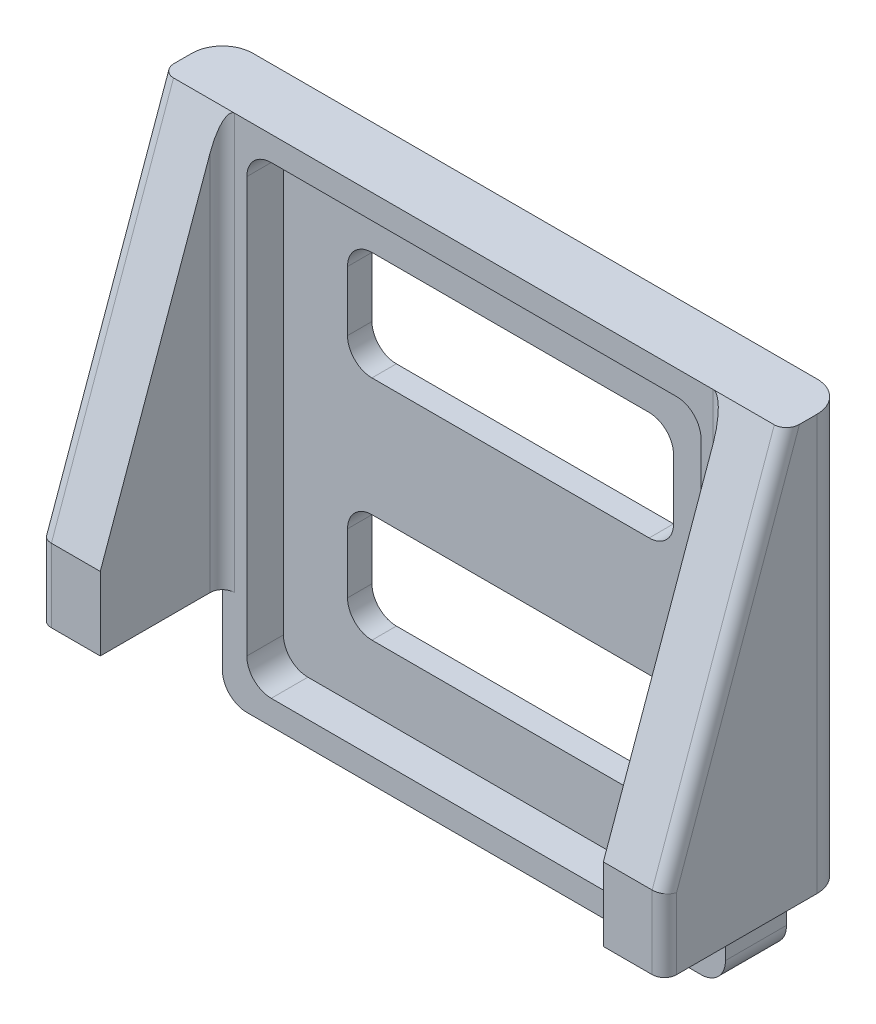
from build123d import *

# Parameters (mm, degrees)
SKETCH1_W           = 41.2
SKETCH1_H           = 42
BOSS_EXTRUDE1_DEPTH = 5
CUT_EXTRUDE1_DEPTH  = 3
CUT_EXTRUDE2_DEPTH  = 2
SKETCH6_W           = 5
SKETCH6_H           = 6
BOSS_EXTRUDE2_DEPTH = 5
SKETCH7_W           = 5
SKETCH7_H           = 6
BOSS_EXTRUDE3_DEPTH = 5
SKETCH13_W          = 5
SKETCH13_H          = 6
BOSS_EXTRUDE6_DEPTH = 10
SKETCH10_R          = 1.5
CUT_EXTRUDE3_DEPTH  = 6
FILLET4_R           = 2.5
BOSS_EXTRUDE7_DEPTH = 28
BOSS_EXTRUDE8_DEPTH = 5
FILLET10_R          = 1
FILLET12_R          = 2
FILLET13_R          = 1
FILLET14_R          = 1


with BuildPart() as part:
    # Sketch1 → Boss-Extrude1 (new body)
    with BuildSketch(Plane.XY):
        with Locations((20.6, -21)):
            Rectangle(SKETCH1_W, SKETCH1_H)
    extrude(amount=BOSS_EXTRUDE1_DEPTH)

    # Sketch2 → Cut-Extrude1 (cut)
    with BuildSketch(Plane.XY.offset(5)):
        with BuildLine():
            Line((4, -2), (37.2, -2))
            ThreePointArc((37.2, -2), (38.614213562, -2.585786438), (39.2, -4))
            Line((39.2, -4), (39.2, -38))
            ThreePointArc((39.2, -38), (38.614213562, -39.414213562), (37.2, -40))
            Line((37.2, -40), (4, -40))
            ThreePointArc((4, -40), (2.585786438, -39.414213562), (2, -38))
            Line((2, -38), (2, -4))
            ThreePointArc((2, -4), (2.585786438, -2.585786438), (4, -2))
        make_face()
    extrude(amount=-CUT_EXTRUDE1_DEPTH, mode=Mode.SUBTRACT)

    # Sketch3 → Cut-Extrude2 (cut)
    with BuildSketch(Plane.XY.offset(2)):
        with BuildLine():
            Line((9.25, -7.25), (31.95, -7.25))
            ThreePointArc((31.95, -7.25), (33.364213562, -7.835786438), (33.95, -9.25))
            Line((33.95, -9.25), (33.95, -14.15))
            ThreePointArc((33.95, -14.15), (33.364213562, -15.564213562), (31.95, -16.15))
            Line((31.95, -16.15), (9.25, -16.15))
            ThreePointArc((9.25, -16.15), (7.835786438, -15.564213562), (7.25, -14.15))
            Line((7.25, -14.15), (7.25, -9.25))
            ThreePointArc((7.25, -9.25), (7.835786438, -7.835786438), (9.25, -7.25))
        make_face()
        with BuildLine():
            Line((9.25, -25.85), (31.95, -25.85))
            ThreePointArc((31.95, -25.85), (33.364213562, -26.435786438), (33.95, -27.85))
            Line((33.95, -27.85), (33.95, -32.75))
            ThreePointArc((33.95, -32.75), (33.364213562, -34.164213562), (31.95, -34.75))
            Line((31.95, -34.75), (9.25, -34.75))
            ThreePointArc((9.25, -34.75), (7.835786438, -34.164213562), (7.25, -32.75))
            Line((7.25, -32.75), (7.25, -27.85))
            ThreePointArc((7.25, -27.85), (7.835786438, -26.435786438), (9.25, -25.85))
        make_face()
    extrude(amount=-CUT_EXTRUDE2_DEPTH, mode=Mode.SUBTRACT)

    # Sketch6 → Boss-Extrude2 (add)
    with BuildSketch(Plane(origin=(41.2, 0, 0), x_dir=(0, 0, -1), z_dir=(1, 0, 0))):
        with Locations((-2.5, -31)):
            Rectangle(SKETCH6_W, SKETCH6_H)
    extrude(amount=BOSS_EXTRUDE2_DEPTH)

    # Sketch7 → Boss-Extrude3 (add)
    with BuildSketch(Plane.ZY):
        with Locations((2.5, -31)):
            Rectangle(SKETCH7_W, SKETCH7_H)
    extrude(amount=BOSS_EXTRUDE3_DEPTH)

    # Sketch13 → Boss-Extrude6 (add)
    with BuildSketch(Plane.XY.offset(5)):
        with Locations((43.7, -31)):
            Rectangle(SKETCH13_W, SKETCH13_H)
        with Locations((-2.5, -31)):
            Rectangle(SKETCH13_W, SKETCH13_H)
    extrude(amount=BOSS_EXTRUDE6_DEPTH)

    # Sketch10 → Cut-Extrude3 (cut)
    with BuildSketch(Plane(origin=(0, -28, 0), x_dir=(1, 0, 0), z_dir=(0, 1, 0))):
        with Locations(Location((43.7, -3, 0), (0, 0, 180))):
            Circle(SKETCH10_R)
        with Locations(Location((43.7, -12, 0), (0, 0, 180))):
            Circle(SKETCH10_R)
    cut_extrude3 = extrude(amount=-CUT_EXTRUDE3_DEPTH, mode=Mode.SUBTRACT)

    # Mirror1: Cut-Extrude3 across plane
    add(cut_extrude3.mirror(Plane(origin=(20.6, 0, 0), x_dir=(0, 0, 1), z_dir=(1, 0, 0))), mode=Mode.SUBTRACT)

    # Fillet4
    fillet4_edges = [part.edges().sort_by_distance(p)[0] for p in [
        (-5, -31, 0),
        (46.2, -31, 0),
    ]]
    fillet(fillet4_edges, radius=FILLET4_R)

    # Sketch16 → Boss-Extrude7 (add)
    with BuildSketch(Plane(origin=(0, -28, 0), x_dir=(1, 0, 0), z_dir=(0, 1, 0))):
        with BuildLine():
            Line((41.2, 0), (43.7, 0))
            ThreePointArc((43.7, 0), (45.467766953, -0.732233047), (46.2, -2.5))
            Line((46.2, -2.5), (46.2, -5))
            Line((46.2, -5), (41.2, -5))
            Line((41.2, -5), (41.2, 0))
        make_face()
    boss_extrude7 = extrude(amount=BOSS_EXTRUDE7_DEPTH)

    # Sketch17 → Boss-Extrude8 (add)
    with BuildSketch(Plane(origin=(46.2, 0, 0), x_dir=(0, 0, -1), z_dir=(1, 0, 0))):
        Polygon((-5, 0), (-15, -28), (-5, -28), align=None)
    boss_extrude8 = extrude(amount=-BOSS_EXTRUDE8_DEPTH)

    # Fillet10
    fillet10_edges = [part.edges().sort_by_distance(p)[0] for p in [
        (46.2, -31, 15),
        (46.2, -14, 10),
    ]]
    fillet(fillet10_edges, radius=FILLET10_R)

    # Mirror3: Boss-Extrude7, Boss-Extrude8 across plane
    add(boss_extrude7.mirror(Plane(origin=(20.6, 0, 0), x_dir=(0, 0, 1), z_dir=(1, 0, 0))))
    add(boss_extrude8.mirror(Plane(origin=(20.6, 0, 0), x_dir=(0, 0, 1), z_dir=(1, 0, 0))))

    # Fillet12
    fillet12_edges = [part.edges().sort_by_distance(p)[0] for p in [
        (41.2, -42, 2.5),
        (0, -42, 2.5),
    ]]
    fillet(fillet12_edges, radius=FILLET12_R)

    # Fillet13
    fillet13_edges = [part.edges().sort_by_distance(p)[0] for p in [
        (-5, -31, 15),
        (-5, -14, 10),
    ]]
    fillet(fillet13_edges, radius=FILLET13_R)

    # Fillet14
    fillet14_edges = [part.edges().sort_by_distance(p)[0] for p in [
        (41.2, -17, 5),
        (0, -17, 5),
    ]]
    fillet(fillet14_edges, radius=FILLET14_R)


solid = part.part
